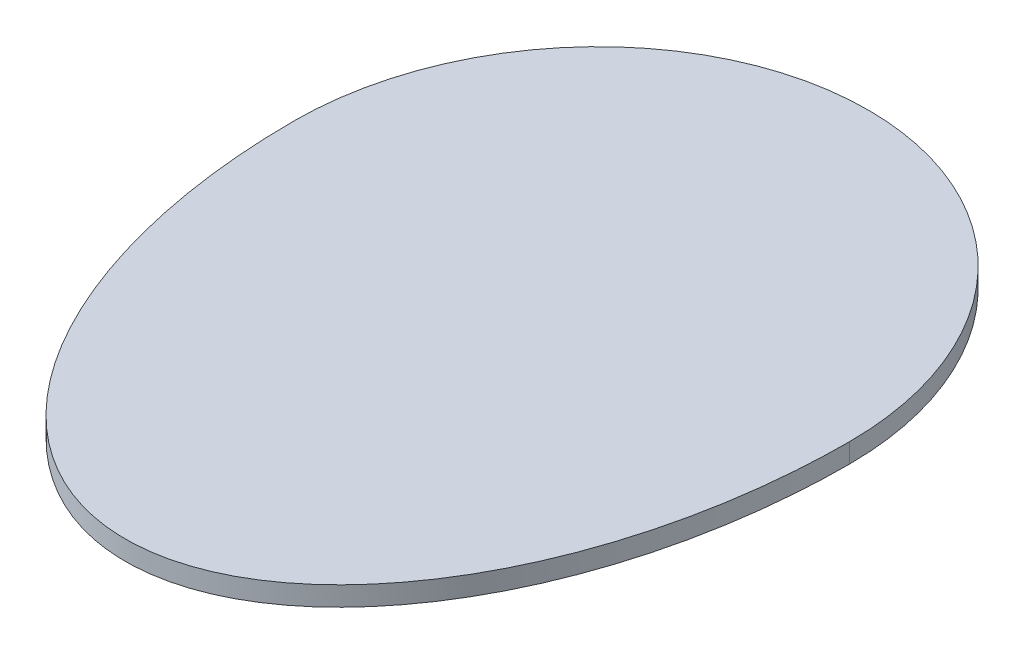
from build123d import *

# Parameters (mm, degrees)
BOSS_EXTRUDE1_DEPTH = 7


with BuildPart() as part:
    # Sketch4 → Boss-Extrude1 (new body)
    with BuildSketch(Plane(origin=(0, 0, 0), x_dir=(1, 0, 0), z_dir=(0, 1, 0))):
        with BuildLine():
            add(Edge.make_bspline(
                [(100, 0), (100, 106.76), (0, 106.76), (-100, 106.76), (-100, 0)],
                knots=[4.71238898, 4.71238898, 4.71238898, 6.283185307, 6.283185307, 7.853981634, 7.853981634, 7.853981634], degree=2, weights=[1, 0.707106781, 1, 0.707106781, 1]))
            add(Edge.make_bspline(
                [(-100, 0), (-100, -160.73), (0, -160.73), (100, -160.73), (100, 0)],
                knots=[4.71238898, 4.71238898, 4.71238898, 6.283185307, 6.283185307, 7.853981634, 7.853981634, 7.853981634], degree=2, weights=[1, 0.707106781, 1, 0.707106781, 1]))
        make_face()
    extrude(amount=BOSS_EXTRUDE1_DEPTH)


solid = part.part
